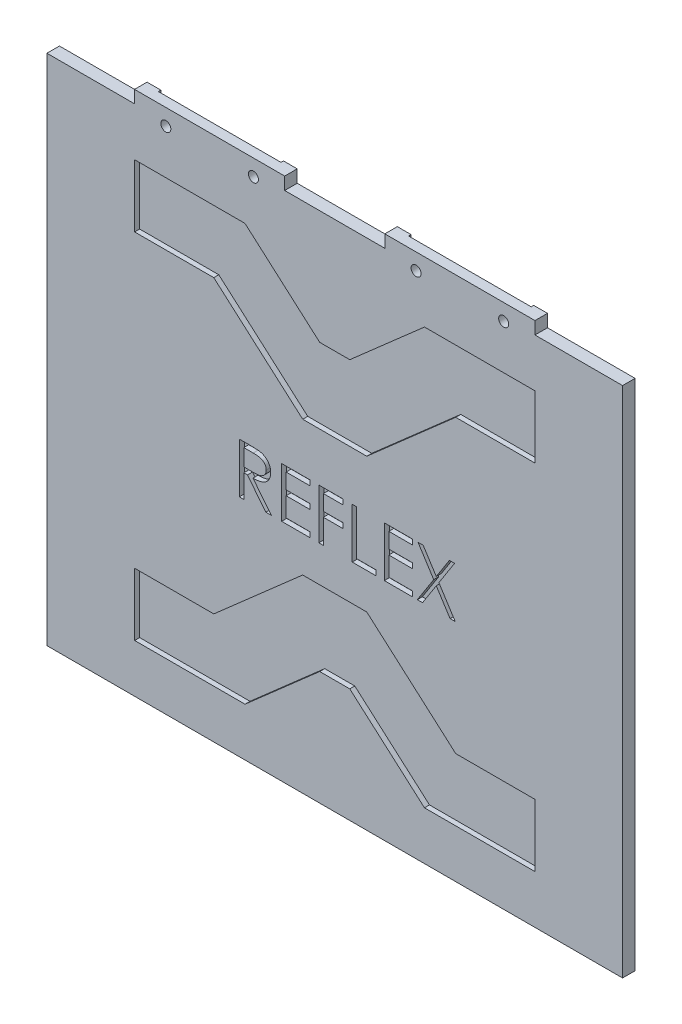
from build123d import *

# Parameters (mm, degrees)
BOSS_EXTRU_1_DEPTH      = 5
ENL_V_MAT_EXTRU_2_DEPTH = 2
ENL_V_MAT_EXTRU_3_DEPTH = 2
ESQUISSE4_W             = 49
ESQUISSE4_H             = 12.519470299
ENL_V_MAT_EXTRU_5_DEPTH = 1
ESQUISSE5_R             = 2
ENL_V_MAT_EXTRU_6_DEPTH = 262.315639817


with BuildPart() as part:
    # Esquisse1 → Boss.-Extru.1 (new body)
    with BuildSketch(Plane.XY):
        Polygon((-56, 10.102941176), (-21, 10.102941176), (-21, 15.102941176), (39, 15.102941176), (39, 10.102941176), (79, 10.102941176), (79, 15.102941176), (139, 15.102941176), (139, 10.102941176), (174, 10.102941176), (174, -194.897058824), (-56, -194.897058824), align=None)
    extrude(amount=BOSS_EXTRU_1_DEPTH)

    # Esquisse2 → Enlèv. mat.-Extru.2 (cut)
    with BuildSketch(Plane.XY.offset(5)):
        Polygon((23.144921781, -9.214330656), (-20.950579999, -9.214330656), (-20.950579999, -34.214330656), (10.659241187, -34.214330656), (46.203012632, -65.443309996), (71.796987368, -65.443309996), (107.340758813, -34.214330656), (138.950579999, -34.214330656), (138.950579999, -9.214330656), (94.855078219, -9.214330656), (65.002138205, -35.443309996), (52.997861795, -35.443309996), align=None)
        Polygon((10.659241187, -150.579786991), (-20.950579999, -150.579786991), (-20.950579999, -175.579786991), (23.144921781, -175.579786991), (52.997861795, -149.350807651), (65.002138205, -149.350807651), (94.855078219, -175.579786991), (138.950579999, -175.579786991), (138.950579999, -150.579786991), (107.340758813, -150.579786991), (71.796987368, -119.350807651), (46.203012632, -119.350807651), align=None)
    extrude(amount=-ENL_V_MAT_EXTRU_2_DEPTH, mode=Mode.SUBTRACT)

    # Esquisse3 → Enlèv. mat.-Extru.3 (cut)
    # profile 1 of 6: a face of its own
    with BuildSketch(Plane.XY.offset(5)):
        with BuildLine():
            Line((20.856664396, -84.979311094), (24.859068242, -84.979311094))
            add(Edge.make_bspline(
                [(24.859068242, -84.979311094), (25.126160405, -84.980200157), (25.639006945, -84.981907256), (26.373711347, -84.991425901), (27.041294758, -85.018707934), (27.641408126, -85.042185554), (28.17404044, -85.084996647), (28.640824959, -85.125914631), (29.039611801, -85.179478407), (29.281016666, -85.229223681), (29.390318242, -85.251746992)],
                knots=[0, 0, 0, 0, 1.410062039, 2.707475311, 3.878576406, 4.937260626, 5.877586885, 6.699081471, 7.410979367, 8, 8, 8, 8], degree=3))
            add(Edge.make_bspline(
                [(29.390318242, -85.251746992), (29.536641809, -85.287899937), (29.826167463, -85.359434586), (30.243024983, -85.510632305), (30.640249692, -85.685601589), (31.016191545, -85.891108562), (31.368967495, -86.128678732), (31.702214985, -86.39421086), (32.017446204, -86.686252036), (32.301912662, -87.012165416), (32.570135815, -87.354088328), (32.796356538, -87.723824081), (32.991364993, -88.110461382), (33.14662509, -88.51793234), (33.271642082, -88.942285322), (33.359792021, -89.387364161), (33.41265595, -89.851141161), (33.418037982, -90.167472069), (33.42076696, -90.327868787)],
                knots=[0, 0, 0, 0, 1.027469482, 2.033020251, 3.019912614, 3.986113645, 4.951240523, 5.91722682, 6.890402269, 7.87763091, 8.8651537, 9.85103654, 10.82876324, 11.815024772, 12.821070561, 13.842952187, 14.906261191, 16, 16, 16, 16], degree=3))
            add(Edge.make_bspline(
                [(33.42076696, -90.327868787), (33.412372686, -90.594355099), (33.395993281, -91.114338915), (33.243278403, -91.868972523), (32.993126862, -92.572911464), (32.648422353, -93.225269395), (32.20945392, -93.813330226), (31.681883685, -94.329847113), (31.065417334, -94.762075185), (30.491535529, -95.061805498), (29.984597245, -95.253764975), (29.567264029, -95.388829883), (29.112024157, -95.493183971), (28.623239388, -95.586670438), (28.098875642, -95.657251549), (27.540189703, -95.708946374), (26.946783122, -95.741255224), (26.539131297, -95.74606668), (26.329420807, -95.748541864)],
                knots=[0, 0, 0, 0, 1.260483769, 2.459530307, 3.627416485, 4.787058657, 5.939039949, 7.08810263, 8.267026773, 9.491475466, 10.141966685, 10.831826277, 11.566392101, 12.351337768, 13.187381173, 14.07005841, 15.007169909, 16, 16, 16, 16], degree=3))
            Line((26.329420807, -95.748541864), (33.677177217, -104.979311094))
            Line((33.677177217, -104.979311094), (31.457625935, -104.979311094))
            Line((31.457625935, -104.979311094), (24.109869525, -95.748541864))
            Line((24.109869525, -95.748541864), (22.651536191, -95.748541864))
            Line((22.651536191, -95.748541864), (22.651536191, -104.979311094))
            Line((22.651536191, -104.979311094), (20.856664396, -104.979311094))
            Line((20.856664396, -104.979311094), (20.856664396, -84.979311094))
        make_face()
        with BuildLine():
            Line((22.651536191, -87.030593146), (22.651536191, -93.697259812))
            Line((22.651536191, -93.697259812), (26.313395166, -93.725304684))
            add(Edge.make_bspline(
                [(26.313395166, -93.725304684), (26.484366817, -93.725380322), (26.815758571, -93.72552693), (27.295190942, -93.702705352), (27.74159158, -93.676743533), (28.153253021, -93.637032987), (28.530359166, -93.585855434), (28.872721527, -93.521838382), (29.180898966, -93.447255167), (29.540319186, -93.331817305), (29.941670794, -93.148925772), (30.377850564, -92.882837208), (30.749292494, -92.548156527), (31.06310885, -92.165451064), (31.31527703, -91.744672499), (31.493060198, -91.290864675), (31.605874154, -90.815484115), (31.619180128, -90.48875207), (31.625895166, -90.323862376)],
                knots=[0, 0, 0, 0, 1.146690395, 2.22261258, 3.21895312, 4.145990853, 4.996080663, 5.770904154, 6.481378293, 7.121626537, 8.300444488, 9.431385265, 10.535395872, 11.636531494, 12.74115979, 13.810798291, 14.895190096, 16, 16, 16, 16], degree=3))
            add(Edge.make_bspline(
                [(31.625895166, -90.323862376), (31.619025902, -90.163024812), (31.605413529, -89.844303448), (31.494277709, -89.377698247), (31.306338387, -88.937315675), (31.053068456, -88.524947189), (30.744501856, -88.150628698), (30.382685783, -87.830359252), (29.977513239, -87.566076597), (29.598820677, -87.397194423), (29.260339463, -87.293652404), (28.966455692, -87.220788611), (28.634390105, -87.162248788), (28.262530341, -87.115345583), (27.852463879, -87.075031616), (27.402117302, -87.047878595), (26.914478557, -87.031799372), (26.576496094, -87.031004578), (26.401536191, -87.030593146)],
                knots=[0, 0, 0, 0, 1.101028733, 2.181837193, 3.264309656, 4.369019818, 5.486613113, 6.575447106, 7.666700264, 8.788928104, 9.402425223, 10.0903467, 10.862060571, 11.710948788, 12.657782767, 13.684531032, 14.801375019, 16, 16, 16, 16], degree=3))
            Line((26.401536191, -87.030593146), (22.651536191, -87.030593146))
        make_face(mode=Mode.SUBTRACT)
    # profile 2 of 6: a face of its own
    with BuildSketch(Plane.XY.offset(5)):
        Polygon((37.779741319, -84.979311094), (49.061792601, -84.979311094), (49.061792601, -87.030593146), (39.574613114, -87.030593146), (39.574613114, -93.184439299), (49.061792601, -93.184439299), (49.061792601, -95.235721351), (39.574613114, -95.235721351), (39.574613114, -102.928029043), (49.061792601, -102.928029043), (49.061792601, -104.979311094), (37.779741319, -104.979311094), align=None)
    # profile 3 of 6: a face of its own
    with BuildSketch(Plane.XY.offset(5)):
        Polygon((52.651536191, -84.979311094), (62.395125935, -84.979311094), (62.395125935, -87.030593146), (54.446407986, -87.030593146), (54.446407986, -93.184439299), (62.395125935, -93.184439299), (62.395125935, -95.235721351), (54.446407986, -95.235721351), (54.446407986, -104.979311094), (52.651536191, -104.979311094), align=None)
    # profile 4 of 6: a face of its own
    with BuildSketch(Plane.XY.offset(5)):
        Polygon((65.984869525, -84.979311094), (67.779741319, -84.979311094), (67.779741319, -102.928029043), (75.472049012, -102.928029043), (75.472049012, -104.979311094), (65.984869525, -104.979311094), align=None)
    # profile 5 of 6: a face of its own
    with BuildSketch(Plane.XY.offset(5)):
        Polygon((78.805382345, -84.979311094), (90.087433627, -84.979311094), (90.087433627, -87.030593146), (80.60025414, -87.030593146), (80.60025414, -93.184439299), (90.087433627, -93.184439299), (90.087433627, -95.235721351), (80.60025414, -95.235721351), (80.60025414, -102.928029043), (90.087433627, -102.928029043), (90.087433627, -104.979311094), (78.805382345, -104.979311094), align=None)
    # profile 6 of 6: a face of its own
    with BuildSketch(Plane.XY.offset(5)):
        Polygon((92.266920807, -84.979311094), (94.338234909, -84.979311094), (99.574613114, -93.160400838), (104.810991319, -84.979311094), (106.882305422, -84.979311094), (100.612273371, -94.778990582), (107.138715678, -104.979311094), (105.067401576, -104.979311094), (99.574613114, -96.397580325), (94.081824653, -104.979311094), (92.01051055, -104.979311094), (98.540959268, -94.778990582), align=None)
    extrude(amount=-ENL_V_MAT_EXTRU_3_DEPTH, mode=Mode.SUBTRACT)

    # Esquisse4 → Enlèv. mat.-Extru.5 (cut)
    with BuildSketch(Plane(origin=(0, 0, 0), x_dir=(-1, 0, 0), z_dir=(0, 0, -1))):
        with Locations((-9, 8.843206027)):
            Rectangle(ESQUISSE4_W, ESQUISSE4_H)
        with Locations((-109, 8.843206027)):
            Rectangle(ESQUISSE4_W, ESQUISSE4_H)
    extrude(amount=-ENL_V_MAT_EXTRU_5_DEPTH, mode=Mode.SUBTRACT)

    # Esquisse5 → Enlèv. mat.-Extru.6 (cut, through all)
    with BuildSketch(Plane(origin=(0, 0, 0), x_dir=(-1, 0, 0), z_dir=(0, 0, -1))):
        with Locations((8.5, 8.583470877)):
            Circle(ESQUISSE5_R)
        with Locations(Location((-26.5, 8.583470877, 0), (0, 0, 180))):
            Circle(ESQUISSE5_R)
        with Locations((-126.5, 8.583470877)):
            Circle(ESQUISSE5_R)
        with Locations((-91.5, 8.583470877)):
            Circle(ESQUISSE5_R)
    extrude(amount=-ENL_V_MAT_EXTRU_6_DEPTH, mode=Mode.SUBTRACT)


solid = part.part
